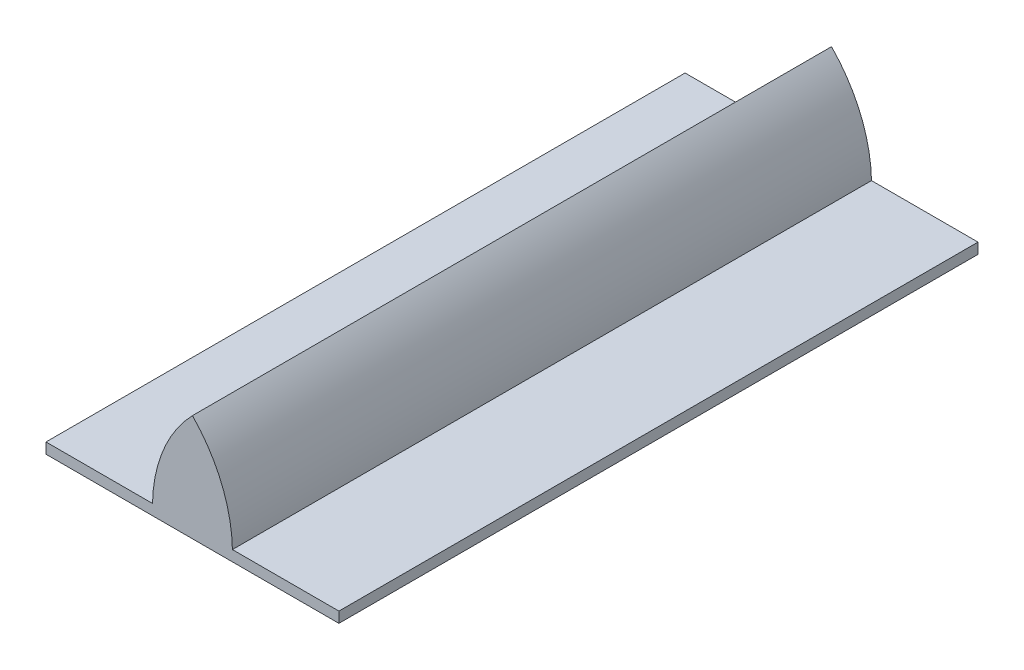
from build123d import *

# Parameters (mm, degrees)
BOSS_EXTRUDE1_DEPTH = 762


with BuildPart() as part:
    # Sketch2 → Boss-Extrude1 (new body)
    with BuildSketch(Plane.XY):
        with BuildLine():
            Line((-295.882088074, -9.629425512), (-168.882088074, -9.629425512))
            Line((-168.882088074, -9.629425512), (-73.62851045, -9.629425512))
            Line((-73.62851045, -9.629425512), (53.37148955, -9.629425512))
            Line((53.37148955, -9.629425512), (53.37148955, 3.070574488))
            Line((53.37148955, 3.070574488), (-73.62851045, 3.070574488))
            ThreePointArc((-73.62851045, 3.070574488), (-86.550085837, 64.860670535), (-121.255299262, 117.59141338))
            ThreePointArc((-121.255299262, 117.59141338), (-155.960512688, 64.860670535), (-168.882088074, 3.070574488))
            Line((-168.882088074, 3.070574488), (-295.882088074, 3.070574488))
            Line((-295.882088074, 3.070574488), (-295.882088074, -9.629425512))
        make_face()
    extrude(amount=BOSS_EXTRUDE1_DEPTH)


solid = part.part
